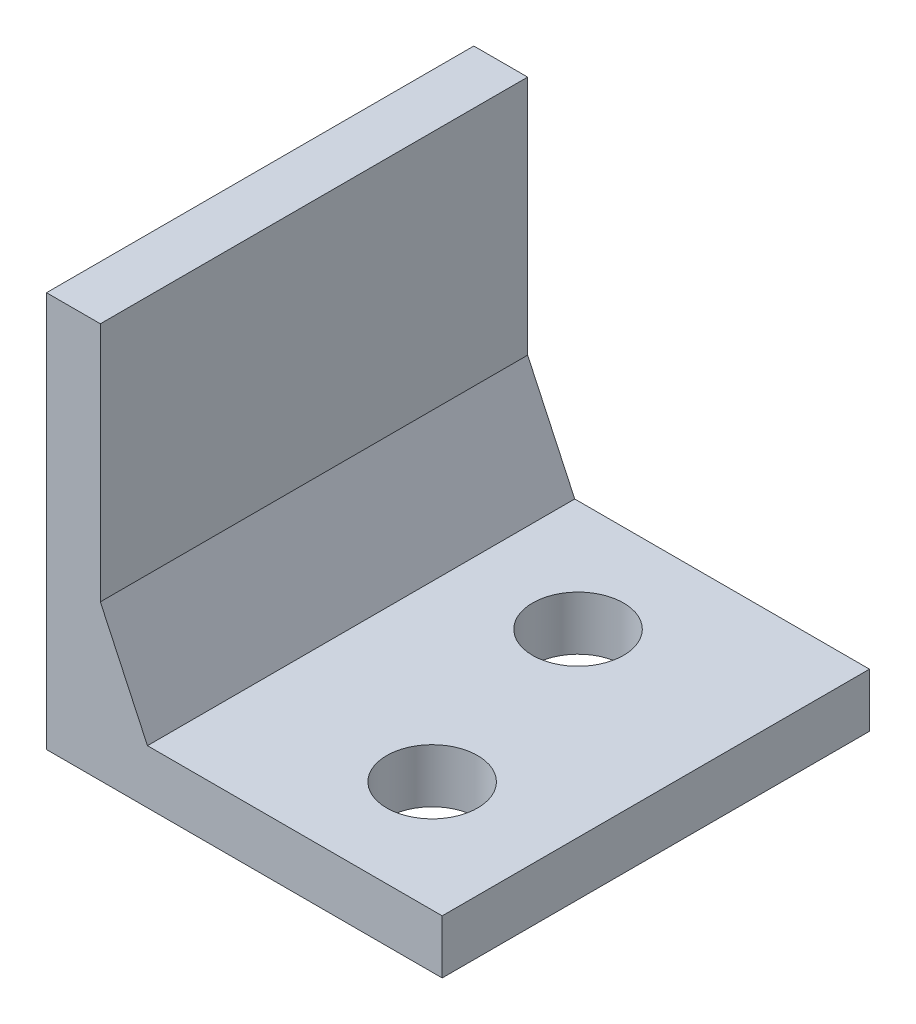
from build123d import *

# Parameters (mm, degrees)
BOSS_EXTRUDE1_DEPTH     = 31.75
F_1_4_CLEARANCE_HOLE1_D = 6.7564
CHAMFER1_SIZE           = 3.5
CHAMFER1_SIZE2          = 7.505774222


with BuildPart() as part:
    # Sketch1 → Boss-Extrude1 (new body)
    with BuildSketch(Plane.XY):
        Polygon((0, 0), (0, 29.4), (4, 29.4), (4, 4), (29.4, 4), (29.4, 0), align=None)
    extrude(amount=BOSS_EXTRUDE1_DEPTH)

    # 1/4 Clearance Hole1 (through all)
    with Locations(Plane(origin=(0, 4, 0), x_dir=(1, 0, 0), z_dir=(0, 1, 0))):
        with Locations((20.4, -23.495), (16, -8.255)):
            Hole(F_1_4_CLEARANCE_HOLE1_D / 2)

    # Chamfer1
    chamfer1_edges = [part.edges().sort_by_distance(p)[0] for p in [
        (4, 4, 15.875),
    ]]
    chamfer1_side = [part.faces().sort_by_distance(p)[0] for p in [
        (16.553612055, 4, 15.875),
    ]]
    chamfer(chamfer1_edges, length=CHAMFER1_SIZE, length2=CHAMFER1_SIZE2, reference=chamfer1_side[0])


solid = part.part
